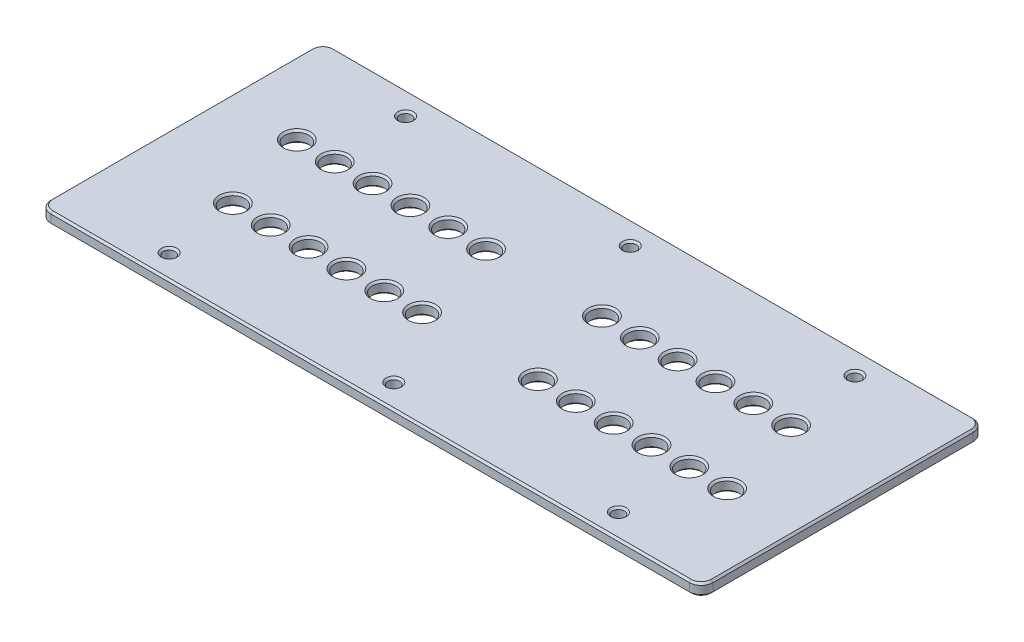
from build123d import *

# Parameters (mm, degrees)
SKETCH1_W                    = 177.8
SKETCH1_H                    = 76.2
BOSS_EXTRUDE1_DEPTH          = 1.5875
F_1_8_0_125_DIAMETER_HOLE1_D = 3.175
F_1_4_0_25_DIAMETER_HOLE1_D  = 6.35
FILLET1_R                    = 3.175
CHAMFER1_SIZE                = 0.508


with BuildPart() as part:
    # Sketch1 → Boss-Extrude1 (new, symmetric)
    with BuildSketch(Plane(origin=(0, 0, 0), x_dir=(1, 0, 0), z_dir=(0, 1, 0))):
        Rectangle(SKETCH1_W, SKETCH1_H)
    extrude(amount=BOSS_EXTRUDE1_DEPTH, both=True)

    # 1/8 (0.125) Diameter Hole1 (through all)
    with Locations(Plane(origin=(0, 1.5875, 0), x_dir=(1, 0, 0), z_dir=(0, 1, 0))):
        with Locations((-60.325, 31.75), (0, 31.75), (60.325, 31.75), (60.325, -31.75), (0, -31.75), (-60.325, -31.75)):
            Hole(F_1_8_0_125_DIAMETER_HOLE1_D / 2)

    # 1/4 (0.25) Diameter Hole1 (through all)
    with Locations(Plane(origin=(0, 1.5875, 0), x_dir=(1, 0, 0), z_dir=(0, 1, 0))):
        with Locations((-63.28664, -11.66114), (-53.12664, -11.66114), (-42.96664, -11.66114), (-32.80664, -11.66114), (-22.64664, -11.66114), (-12.48664, -11.66114), (18.62836, -11.66114), (28.78836, -11.66114), (38.94836, -11.66114), (49.10836, -11.66114), (59.26836, -11.66114), (69.42836, -11.66114), (-69.42836, 11.66114), (-59.26836, 11.66114), (-49.10836, 11.66114), (-38.94836, 11.66114), (-28.78836, 11.66114), (-18.62836, 11.66114), (12.48664, 11.66114), (22.64664, 11.66114), (32.80664, 11.66114), (42.96664, 11.66114), (53.12664, 11.66114), (63.28664, 11.66114)):
            Hole(F_1_4_0_25_DIAMETER_HOLE1_D / 2)

    # Fillet1
    fillet1_edges = [part.edges().sort_by_distance(p)[0] for p in [
        (-88.9, 0, 38.1),
        (88.9, 0, 38.1),
        (88.9, 0, -38.1),
        (-88.9, 0, -38.1),
    ]]
    fillet(fillet1_edges, radius=FILLET1_R)

    # Chamfer1
    chamfer1_edges = [part.edges().sort_by_distance(p)[0] for p in [
        (15.66164, 1.5875, -11.66114),
        (15.66164, -1.5875, -11.66114),
        (-15.45336, 1.5875, -11.66114),
        (-15.45336, -1.5875, -11.66114),
        (-25.61336, 1.5875, -11.66114),
        (-25.61336, -1.5875, -11.66114),
        (-35.77336, 1.5875, -11.66114),
        (-35.77336, -1.5875, -11.66114),
        (-45.93336, 1.5875, -11.66114),
        (-45.93336, -1.5875, -11.66114),
        (-56.09336, 1.5875, -11.66114),
        (-56.09336, -1.5875, -11.66114),
        (-66.25336, 1.5875, -11.66114),
        (-66.25336, -1.5875, -11.66114),
        (72.60336, 1.5875, 11.66114),
        (72.60336, -1.5875, 11.66114),
        (-58.7375, 1.5875, 31.75),
        (-58.7375, -1.5875, 31.75),
        (62.44336, 1.5875, 11.66114),
        (62.44336, -1.5875, 11.66114),
        (52.28336, 1.5875, 11.66114),
        (52.28336, -1.5875, 11.66114),
        (42.12336, 1.5875, 11.66114),
        (42.12336, -1.5875, 11.66114),
        (31.96336, 1.5875, 11.66114),
        (31.96336, -1.5875, 11.66114),
        (21.80336, 1.5875, 11.66114),
        (21.80336, -1.5875, 11.66114),
        (-9.31164, 1.5875, 11.66114),
        (-9.31164, -1.5875, 11.66114),
        (1.5875, 1.5875, 31.75),
        (1.5875, -1.5875, 31.75),
        (-19.47164, 1.5875, 11.66114),
        (-19.47164, -1.5875, 11.66114),
        (-29.63164, 1.5875, 11.66114),
        (-29.63164, -1.5875, 11.66114),
        (-39.79164, 1.5875, 11.66114),
        (-39.79164, -1.5875, 11.66114),
        (-49.95164, 1.5875, 11.66114),
        (-49.95164, -1.5875, 11.66114),
        (-60.11164, 1.5875, 11.66114),
        (-60.11164, -1.5875, 11.66114),
        (-88.9, -1.5875, 0),
        (-88.9, 1.5875, 0),
        (0, -1.5875, -38.1),
        (88.9, -1.5875, 0),
        (0, -1.5875, 38.1),
        (61.9125, 1.5875, 31.75),
        (-87.97006403, -1.5875, 37.17006403),
        (87.97006403, -1.5875, 37.17006403),
        (61.9125, -1.5875, 31.75),
        (87.97006403, -1.5875, -37.17006403),
        (-87.97006403, -1.5875, -37.17006403),
        (0, 1.5875, -38.1),
        (0, 1.5875, 38.1),
        (88.9, 1.5875, 0),
        (-87.97006403, 1.5875, 37.17006403),
        (87.97006403, 1.5875, 37.17006403),
        (87.97006403, 1.5875, -37.17006403),
        (-87.97006403, 1.5875, -37.17006403),
        (61.9125, 1.5875, -31.75),
        (61.9125, -1.5875, -31.75),
        (1.5875, 1.5875, -31.75),
        (1.5875, -1.5875, -31.75),
        (-58.7375, 1.5875, -31.75),
        (-58.7375, -1.5875, -31.75),
        (56.30164, 1.5875, -11.66114),
        (56.30164, -1.5875, -11.66114),
        (66.46164, 1.5875, -11.66114),
        (66.46164, -1.5875, -11.66114),
        (46.14164, 1.5875, -11.66114),
        (46.14164, -1.5875, -11.66114),
        (35.98164, 1.5875, -11.66114),
        (35.98164, -1.5875, -11.66114),
        (25.82164, 1.5875, -11.66114),
        (25.82164, -1.5875, -11.66114),
    ]]
    chamfer(chamfer1_edges, length=CHAMFER1_SIZE)


solid = part.part
